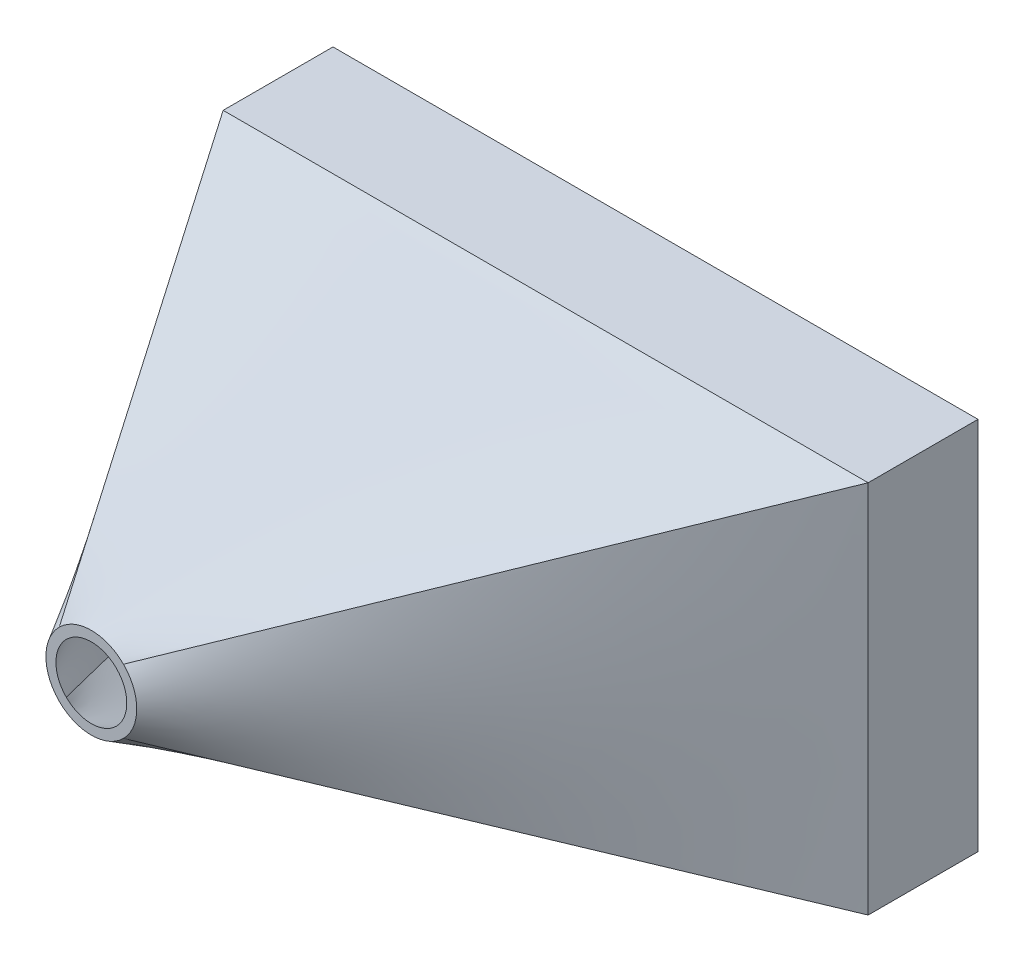
from build123d import *

# Parameters (mm, degrees)
SKETCH_1_W          = 129.2
SKETCH_1_H          = 75
SKETCH_1_W_2        = 125.2
SKETCH_1_H_2        = 71
EXTRUDE_1_DEPTH     = 22
SKETCH_11_W         = 125.2
SKETCH_11_H         = 22
CUT_EXTRUDE_1_DEPTH = 10


with BuildPart() as part:
    # 草图1 → 凸台-拉伸1 (new body)
    with BuildSketch(Plane.XY):
        Rectangle(SKETCH_1_W, SKETCH_1_H)
        Rectangle(SKETCH_1_W_2, SKETCH_1_H_2, mode=Mode.SUBTRACT)
    extrude(amount=EXTRUDE_1_DEPTH)

    # 草图2 → 放样1 section 0
    with BuildSketch(Plane.XY.offset(22)):
        with BuildLine():
            Line((-64.6, 37.5), (-62.6, 35.5))
            Line((-62.6, 35.5), (62.6, 35.5))
            Line((62.6, 35.5), (64.6, 37.5))
            Line((64.6, 37.5), (-64.6, 37.5))
        make_face()
    # 草图6 for 放样1 → 放样1 section 1
    with BuildSketch(Plane.XY.offset(96)):
        with BuildLine():
            Line((-22.020458146, 4.020458146), (-23.434671709, 5.434671709))
            # circular arc as an exact rational Bezier (weights 1, cos(half-angle), 1)
            Bezier((-23.434671709, 5.434671709), (-17, 11.869343418), (-10.565328291, 5.434671709), weights=[1, 0.707106781, 1])
            Line((-10.565328291, 5.434671709), (-11.979541854, 4.020458146))
            Bezier((-11.979541854, 4.020458146), (-17, 9.040916293), (-22.020458146, 4.020458146), weights=[1, 0.707106781, 1])
        make_face()
    loft()

    # 草图3 → 放样2 section 0
    with BuildSketch(Plane.XY.offset(22)):
        with BuildLine():
            Line((-62.6, 35.5), (-64.6, 37.5))
            Line((-64.6, 37.5), (-64.6, -37.5))
            Line((-64.6, -37.5), (-62.6, -35.5))
            Line((-62.6, -35.5), (-62.6, 35.5))
        make_face()
    # 草图7 for 放样2 → 放样2 section 1
    with BuildSketch(Plane.XY.offset(96)):
        with BuildLine():
            Line((-22.020458146, 4.020458146), (-23.434671709, 5.434671709))
            Bezier((-23.434671709, 5.434671709), (-29.869343418, -1), (-23.434671709, -7.434671709), weights=[1, 0.707106781, 1])
            Line((-23.434671709, -7.434671709), (-22.020458146, -6.020458146))
            Bezier((-22.020458146, -6.020458146), (-27.040916293, -1), (-22.020458146, 4.020458146), weights=[1, 0.707106781, 1])
        make_face()
    loft()

    # 草图4 → 放样3 section 0
    with BuildSketch(Plane.XY.offset(22)):
        with BuildLine():
            Line((-62.6, -35.5), (-64.6, -37.5))
            Line((-64.6, -37.5), (64.6, -37.5))
            Line((64.6, -37.5), (62.6, -35.5))
            Line((62.6, -35.5), (-62.6, -35.5))
        make_face()
    # 草图8 for 放样3 → 放样3 section 1
    with BuildSketch(Plane.XY.offset(96)):
        with BuildLine():
            Line((-22.020458146, -6.020458146), (-23.434671709, -7.434671709))
            Bezier((-23.434671709, -7.434671709), (-17, -13.869343418), (-10.565328291, -7.434671709), weights=[1, 0.707106781, 1])
            Line((-10.565328291, -7.434671709), (-11.979541854, -6.020458146))
            Bezier((-11.979541854, -6.020458146), (-17, -11.040916293), (-22.020458146, -6.020458146), weights=[1, 0.707106781, 1])
        make_face()
    loft()

    # 草图5 → 放样4 section 0
    with BuildSketch(Plane.XY.offset(22)):
        with BuildLine():
            Line((64.6, 37.5), (62.6, 35.5))
            Line((62.6, 35.5), (62.6, -35.5))
            Line((62.6, -35.5), (64.6, -37.5))
            Line((64.6, -37.5), (64.6, 37.5))
        make_face()
    # 草图9 for 放样4 → 放样4 section 1
    with BuildSketch(Plane.XY.offset(96)):
        with BuildLine():
            Line((-10.565328291, 5.434671709), (-11.979541854, 4.020458146))
            Bezier((-11.979541854, 4.020458146), (-6.959083707, -1), (-11.979541854, -6.020458146), weights=[1, 0.707106781, 1])
            Line((-11.979541854, -6.020458146), (-10.565328291, -7.434671709))
            Bezier((-10.565328291, -7.434671709), (-4.130656582, -1), (-10.565328291, 5.434671709), weights=[1, 0.707106781, 1])
        make_face()
    loft()

    # 草图11 → 切除-拉伸1 (cut)
    with BuildSketch(Plane(origin=(0, -35.5, 0), x_dir=(1, 0, 0), z_dir=(0, 1, 0))):
        with Locations((0, -11)):
            Rectangle(SKETCH_11_W, SKETCH_11_H)
    extrude(amount=-CUT_EXTRUDE_1_DEPTH, mode=Mode.SUBTRACT)


solid = part.part
